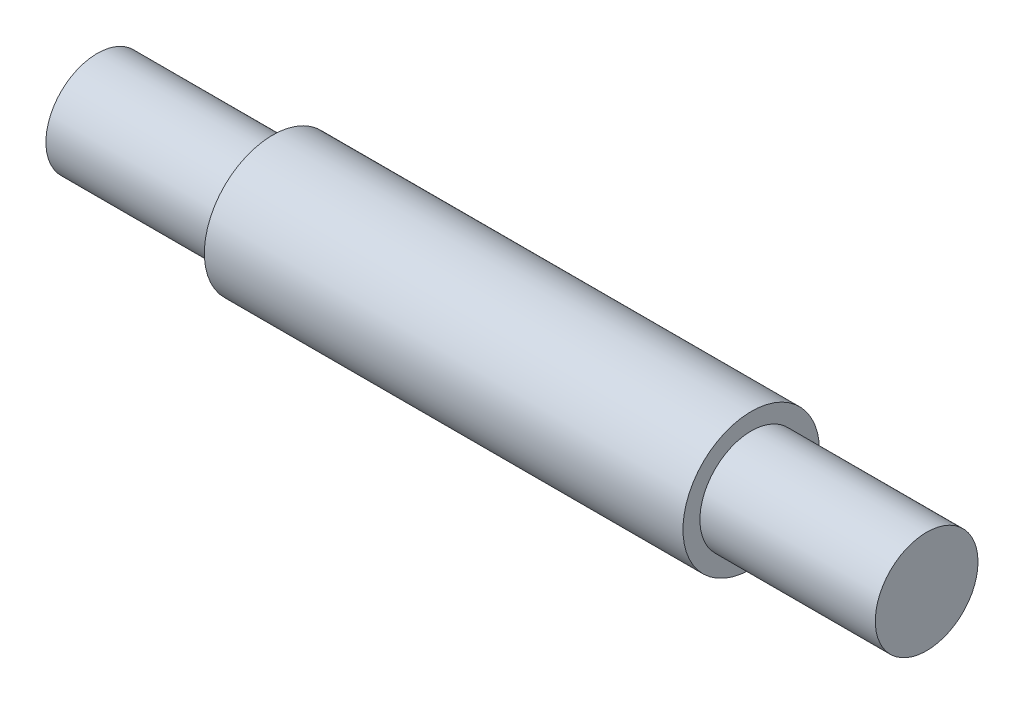
from build123d import *

# Parameters (mm, degrees)
SKETCH1_R           = 3.175
BOSS_EXTRUDE1_DEPTH = 19.2786
SKETCH2_R           = 3.175
SKETCH2_R_2         = 2.3876
CUT_EXTRUDE1_DEPTH  = 8.1534


with BuildPart() as part:
    # Sketch1 → Boss-Extrude1 (new, symmetric)
    with BuildSketch(Plane(origin=(0, 0, 0), x_dir=(0, 0, -1), z_dir=(1, 0, 0))):
        Circle(SKETCH1_R)
    extrude(amount=BOSS_EXTRUDE1_DEPTH, both=True)

    # Sketch2 → Cut-Extrude1 (cut)
    with BuildSketch(Plane(origin=(19.2786, 0, 0), x_dir=(0, 0, -1), z_dir=(1, 0, 0))):
        Circle(SKETCH2_R)
        Circle(SKETCH2_R_2, mode=Mode.SUBTRACT)
    cut_extrude1 = extrude(amount=-CUT_EXTRUDE1_DEPTH, mode=Mode.SUBTRACT)

    # Mirror1: Cut-Extrude1 across plane
    add(cut_extrude1.mirror(Plane(origin=(0, 0, 0), x_dir=(0, 0, 1), z_dir=(1, 0, 0))), mode=Mode.SUBTRACT)


solid = part.part
